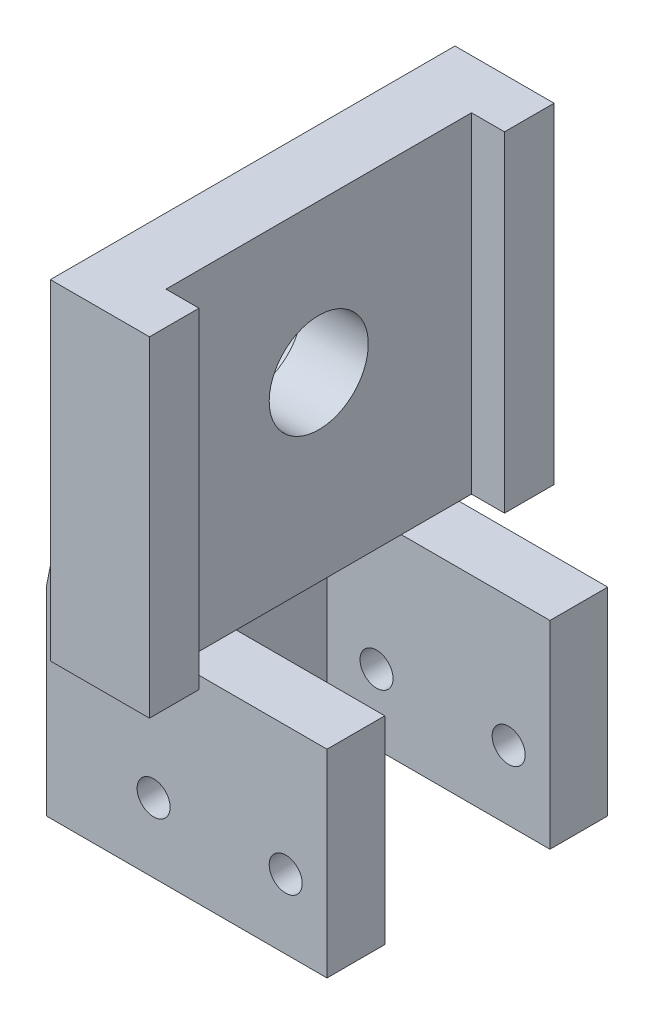
from build123d import *

# Parameters (mm, degrees)
BOSS_EXTRUDE1_DEPTH = 20
SKETCH3_R           = 3
CUT_EXTRUDE1_DEPTH  = 4
BOSS_EXTRUDE2_DEPTH = 12
SKETCH5_R           = 1
CUT_EXTRUDE2_DEPTH  = 17
BOSS_EXTRUDE3_DEPTH = 17
SKETCH10_R          = 6.25
CUT_EXTRUDE3_DEPTH  = 4
BOSS_EXTRUDE4_DEPTH = 10


with BuildPart() as part:
    # Sketch2 → Boss-Extrude1 (new body)
    with BuildSketch(Plane(origin=(0, 0, 0), x_dir=(1, 0, 0), z_dir=(0, 1, 0))):
        Polygon((-29.519694138, 7.160148579), (-29.519694138, -17.339851421), (-23.519694138, -17.339851421), (-23.519694138, -14.339851421), (-25.519694138, -14.339851421), (-25.519694138, 4.160148579), (-23.519694138, 4.160148579), (-23.519694138, 7.160148579), align=None)
    extrude(amount=BOSS_EXTRUDE1_DEPTH)

    # Sketch3 → Cut-Extrude1 (cut)
    with BuildSketch(Plane.ZY.offset(29.519694138)):
        with Locations((5.089851421, 11)):
            Circle(SKETCH3_R)
    extrude(amount=-CUT_EXTRUDE1_DEPTH, mode=Mode.SUBTRACT)

    # Sketch4 → Boss-Extrude2 (add)
    with BuildSketch(Plane.XZ):
        Polygon((-16.519694138, -3.410148579), (-33.519694138, -3.410148579), (-33.519694138, 13.589851421), (-16.519694138, 13.589851421), (-16.519694138, 10.089851421), (-30.019694138, 10.089851421), (-30.019694138, 0.089851421), (-16.519694138, 0.089851421), align=None)
    extrude(amount=BOSS_EXTRUDE2_DEPTH)

    # Sketch5 → Cut-Extrude2 (cut)
    with BuildSketch(Plane(origin=(0, 0, -3.410148579), x_dir=(-1, 0, 0), z_dir=(0, 0, -1))):
        with Locations((19.019694138, -7.8)):
            Circle(SKETCH5_R)
        with Locations((27.019694138, -7.8)):
            Circle(SKETCH5_R)
    extrude(amount=-CUT_EXTRUDE2_DEPTH, mode=Mode.SUBTRACT)

    # Sketch6 → Boss-Extrude3 (add)
    with BuildSketch(Plane(origin=(0, 0, -3.410148579), x_dir=(-1, 0, 0), z_dir=(0, 0, -1))):
        Polygon((33.519694138, 0), (29.519694138, 19.957202976), (29.519694138, 0), align=None)
    extrude(amount=-BOSS_EXTRUDE3_DEPTH)

    # Sketch10 → Cut-Extrude3 (cut)
    with BuildSketch(Plane.ZY.offset(29.519694138)):
        with Locations(Location((5.089851421, 11, 0), (0, 0, 90))):
            Circle(SKETCH10_R)
    extrude(amount=CUT_EXTRUDE3_DEPTH, mode=Mode.SUBTRACT)

    # Sketch11 → Boss-Extrude4 (add)
    with BuildSketch(Plane(origin=(0, 0, 10.089851421), x_dir=(-1, 0, 0), z_dir=(0, 0, -1))):
        Polygon((25.519694138, 0), (30.019694138, -3.647368963), (30.019694138, 0), align=None)
    extrude(amount=BOSS_EXTRUDE4_DEPTH)


solid = part.part
